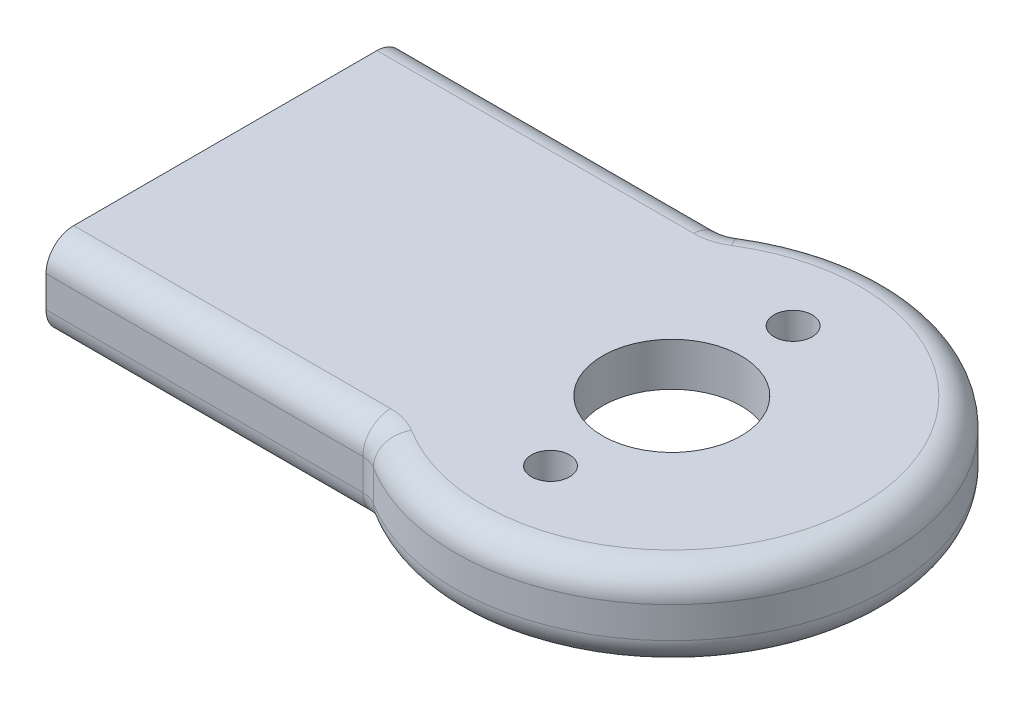
from build123d import *

# Parameters (mm, degrees)
CROQUIS1_R              = 4
CROQUIS1_R_2            = 1.1
SALIENTE_EXTRUIR1_DEPTH = 2.5
CROQUIS2_W              = 13.1
CROQUIS2_H              = 2
CORTAR_EXTRUIR1_DEPTH   = 15
CORTAR_EXTRUIR2_REACH   = 30.748
CROQUIS3_R              = 10.7
REDONDEO1_R             = 1.6


with BuildPart() as part:
    # Croquis1 → Saliente-Extruir1 (new, symmetric)
    with BuildSketch(Plane(origin=(0, 0, 0), x_dir=(1, 0, 0), z_dir=(0, 1, 0))):
        with BuildLine():
            Line((-25.76696336, 10.35), (-7.009101226, 10.35))
            ThreePointArc((-7.009101226, 10.35), (12.5, 0), (-7.009101226, -10.35))
            Line((-7.009101226, -10.35), (-25.76696336, -10.35))
            Line((-25.76696336, -10.35), (-25.76696336, 10.35))
        make_face()
        with Locations(Location((0, 0, 0), (0, 0, 270))):
            Circle(CROQUIS1_R, mode=Mode.SUBTRACT)
        with Locations(Location((0, 7, 0), (0, 0, 270))):
            Circle(CROQUIS1_R_2, mode=Mode.SUBTRACT)
        with Locations(Location((0, -7, 0), (0, 0, 90))):
            Circle(CROQUIS1_R_2, mode=Mode.SUBTRACT)
    extrude(amount=SALIENTE_EXTRUIR1_DEPTH, both=True)

    # Croquis2 → Cortar-Extruir1 (cut)
    with BuildSketch(Plane.ZY.offset(25.76696336)):
        Rectangle(CROQUIS2_W, CROQUIS2_H)
    extrude(amount=-CORTAR_EXTRUIR1_DEPTH, mode=Mode.SUBTRACT)

    # Croquis3 → Cortar-Extruir2 (cut, up to next)
    with BuildSketch(Plane(origin=(0, 0, 0), x_dir=(1, 0, 0), z_dir=(0, 1, 0)), mode=Mode.PRIVATE) as cortar_extruir2_sk1:
        with Locations(Location((0, 0, 0), (0, 0, 270))):
            Circle(CROQUIS3_R)
    cortar_extruir2_tool1 = extrude(cortar_extruir2_sk1.sketch, amount=-CORTAR_EXTRUIR2_REACH, mode=Mode.PRIVATE) & part.part
    add(cortar_extruir2_tool1.solids().sort_by_distance((0, 0, 0))[0], mode=Mode.SUBTRACT)

    # Redondeo1
    redondeo1_edges = [part.edges().sort_by_distance(p)[0] for p in [
        (12.5, 2.5, 0),
        (-16.388032293, 2.5, -10.35),
        (-16.388032293, -2.5, -10.35),
        (12.5, -2.5, 0),
        (-16.388032293, -2.5, 10.35),
        (-16.388032293, 2.5, 10.35),
        (-7.009101226, 0, -10.35),
        (-7.009101226, 0, 10.35),
    ]]
    fillet(redondeo1_edges, radius=REDONDEO1_R)


solid = part.part
